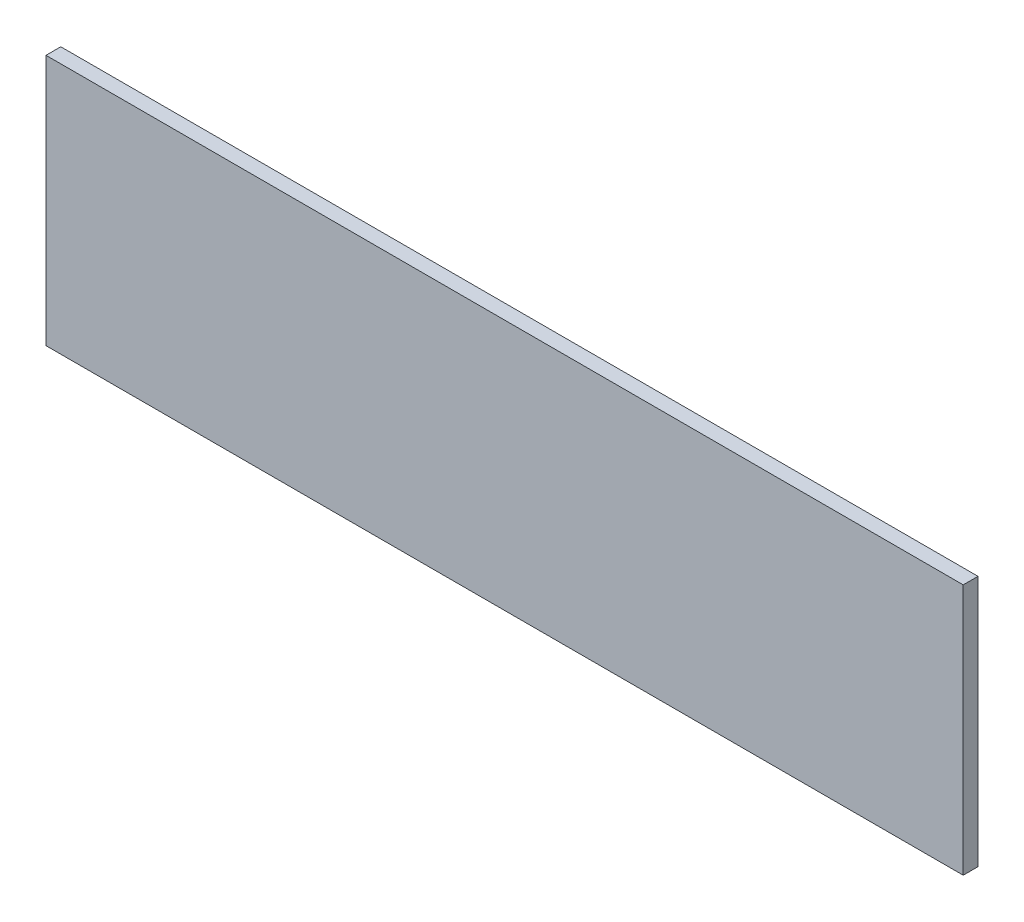
from build123d import *

# Parameters (mm, degrees)
SKETCH1_W           = 124
SKETCH1_H           = 34
BOSS_EXTRUDE1_DEPTH = 2


with BuildPart() as part:
    # Sketch1 → Boss-Extrude1 (new body)
    with BuildSketch(Plane.XY):
        Rectangle(SKETCH1_W, SKETCH1_H)
    extrude(amount=BOSS_EXTRUDE1_DEPTH)


solid = part.part
